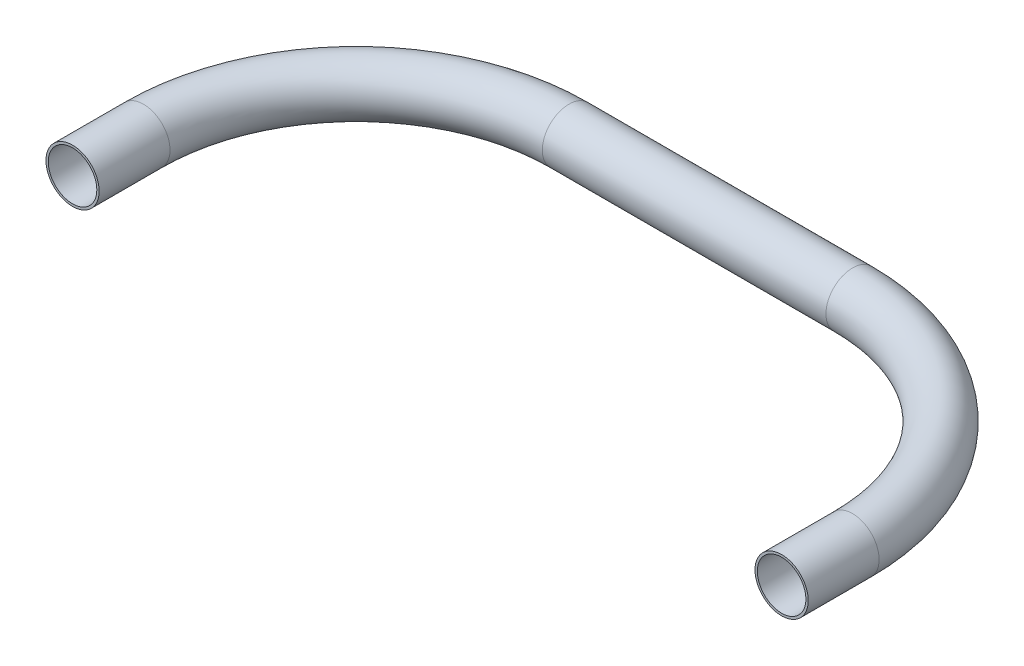
from build123d import *

# Parameters (mm, degrees)
SKETCH4_R   = 19.05
SKETCH4_R_2 = 17.399


with BuildPart() as part:
    # Sweep1: sweep along a path in Sketch1
    with BuildLine(Plane(origin=(0, 0, 0), x_dir=(1, 0, 0), z_dir=(0, 1, 0))) as sweep1_path:
        Line((0, 0), (0, 50.8))
        ThreePointArc((0, 50.8), (-44.636926547, 158.563073453), (-152.4, 203.2))
        Line((-152.4, 203.2), (-355.6, 203.2))
        ThreePointArc((-355.6, 203.2), (-463.363073453, 158.563073453), (-508, 50.8))
        Line((-508, 50.8), (-508, 0))
    # Sketch4 → Sweep1 (sweep)
    with BuildSketch(Plane.XY):
        with Locations((-508, 0)):
            Circle(SKETCH4_R)
        with Locations((-508, 0)):
            Circle(SKETCH4_R_2, mode=Mode.SUBTRACT)
    sweep(path=sweep1_path.line)


solid = part.part
